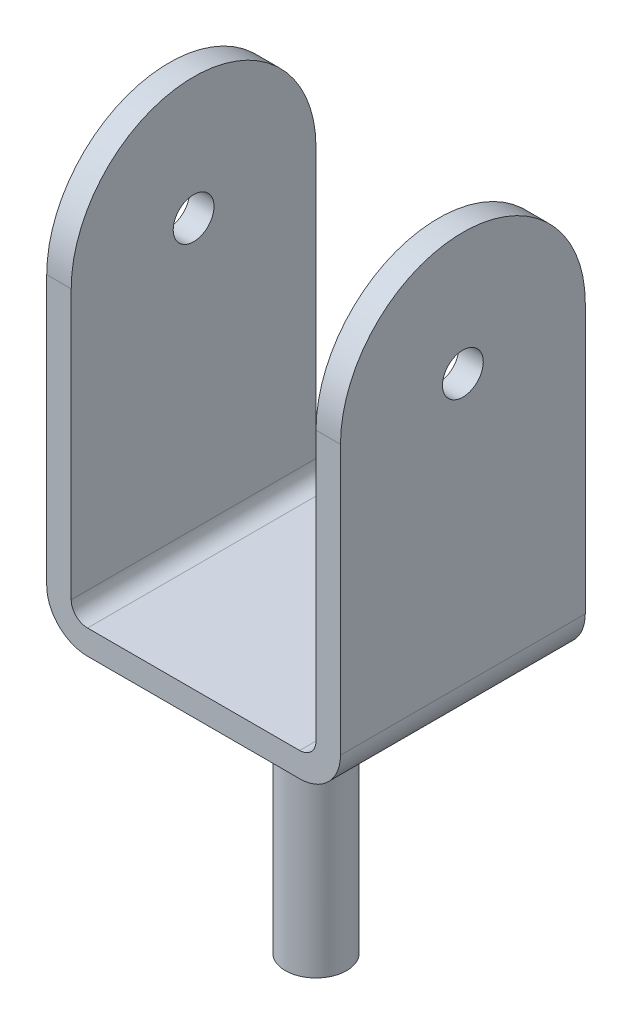
from build123d import *
from build123d.topology import SkipClean

# Parameters (mm, degrees)
BOSS_EXTRUDE1_DEPTH = 300
SKETCH2_R           = 37.5
BOSS_EXTRUDE2_DEPTH = 325
BOSS_EXTRUDE3_DEPTH = 30
SKETCH3_4_R         = 25
CUT_EXTRUDE1_DEPTH  = 360
BOSS_EXTRUDE4_START = -30
BOSS_EXTRUDE4_DEPTH = 30
SKETCH3_9_R         = 25
CUT_EXTRUDE2_DEPTH  = 360


with BuildPart() as part:
    # Sketch1 → Boss-Extrude1 (new body)
    with BuildSketch(Plane.XY):
        with BuildLine():
            Line((-130, 0), (130, 0))
            ThreePointArc((130, 0), (165.355339059, 14.644660941), (180, 50))
            Line((180, 50), (180, 380))
            Line((180, 380), (150, 380))
            Line((150, 380), (150, 50))
            ThreePointArc((150, 50), (144.142135624, 35.857864376), (130, 30))
            Line((130, 30), (-130, 30))
            ThreePointArc((-130, 30), (-144.142135624, 35.857864376), (-150, 50))
            Line((-150, 50), (-150, 380))
            Line((-150, 380), (-180, 380))
            Line((-180, 380), (-180, 50))
            ThreePointArc((-180, 50), (-165.355339059, 14.644660941), (-130, 0))
        make_face()
    extrude(amount=BOSS_EXTRUDE1_DEPTH)

    # Sketch2 → Boss-Extrude2 (add)
    with BuildSketch(Plane.XZ):
        with Locations(Location((0, 150, 0), (0, 0, 90))):
            Circle(SKETCH2_R)
    extrude(amount=BOSS_EXTRUDE2_DEPTH)

    # Sketch3 → Boss-Extrude3 (add)
    with BuildSketch(Plane(origin=(180, 0, 0), x_dir=(0, 0, -1), z_dir=(1, 0, 0))):
        with BuildLine():
            ThreePointArc((0, 380), (-150, 530), (-300, 380))
            Line((-300, 380), (-175, 380))
            ThreePointArc((-175, 380), (-150, 405), (-125, 380))
            Line((-125, 380), (0, 380))
        make_face()
    extrude(amount=-BOSS_EXTRUDE3_DEPTH)

    # Sketch3<4> → Cut-Extrude1 (cut)
    with SkipClean():  # the faces are left unmerged after this step: merging them gives an invalid solid
        with BuildSketch(Plane(origin=(180, 0, 0), x_dir=(0, 0, -1), z_dir=(1, 0, 0))):
            with Locations(Location((-150, 380, 0), (0, 0, 90))):
                Circle(SKETCH3_4_R)
        extrude(amount=-CUT_EXTRUDE1_DEPTH, mode=Mode.SUBTRACT)

    # Sketch6 → Boss-Extrude4 (add)
    with BuildSketch(Plane.ZY.offset(180).offset(BOSS_EXTRUDE4_START)):
        with BuildLine():
            Line((0, 380), (0, 50))
            Line((0, 50), (300, 50))
            Line((300, 50), (300, 380))
            ThreePointArc((300, 380), (150, 530), (0, 380))
        make_face()
    extrude(amount=BOSS_EXTRUDE4_DEPTH)

    # Sketch3<9> → Cut-Extrude2 (cut)
    with BuildSketch(Plane(origin=(180, 0, 0), x_dir=(0, 0, -1), z_dir=(1, 0, 0))):
        with Locations(Location((-150, 380, 0), (0, 0, 90))):
            Circle(SKETCH3_9_R)
    extrude(amount=-CUT_EXTRUDE2_DEPTH, mode=Mode.SUBTRACT)


solid = part.part
